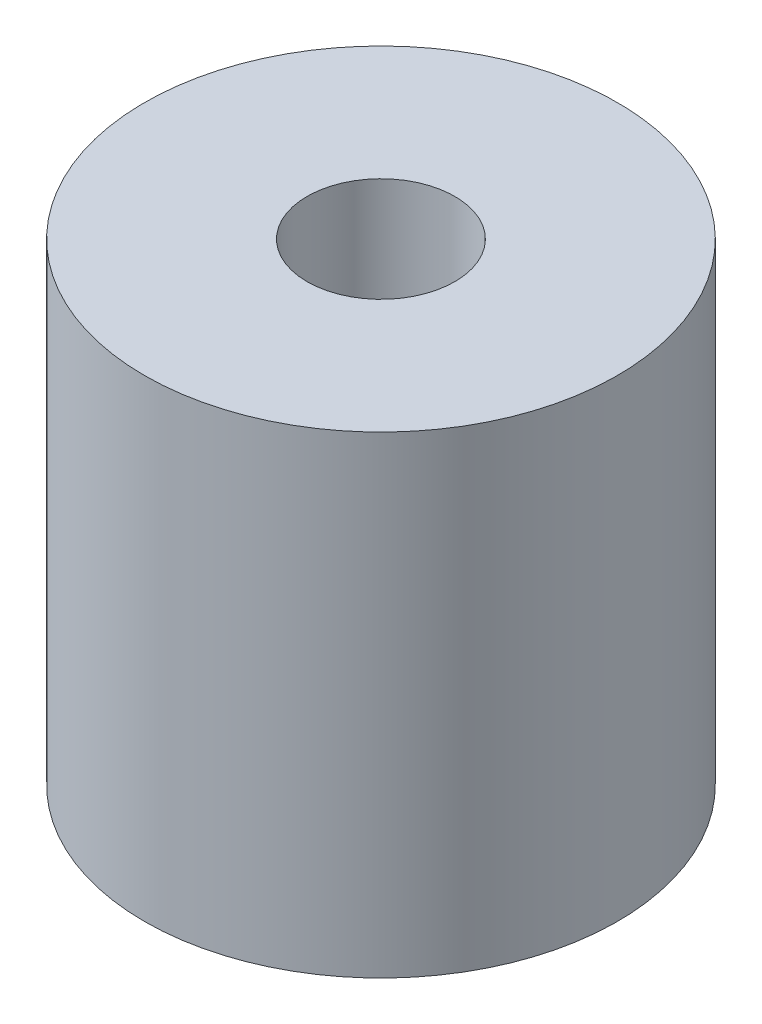
from build123d import *

# Parameters (mm, degrees)
SKETCH1_R           = 8
SKETCH1_R_2         = 2.5
BOSS_EXTRUDE1_DEPTH = 16


with BuildPart() as part:
    # Sketch1 → Boss-Extrude1 (new body)
    with BuildSketch(Plane(origin=(0, 0, 0), x_dir=(1, 0, 0), z_dir=(0, 1, 0))):
        with Locations(Location((0, 0, 0), (0, 0, 270))):
            Circle(SKETCH1_R)
        with Locations(Location((0, 0, 0), (0, 0, 270))):
            Circle(SKETCH1_R_2, mode=Mode.SUBTRACT)
    extrude(amount=BOSS_EXTRUDE1_DEPTH)


solid = part.part
